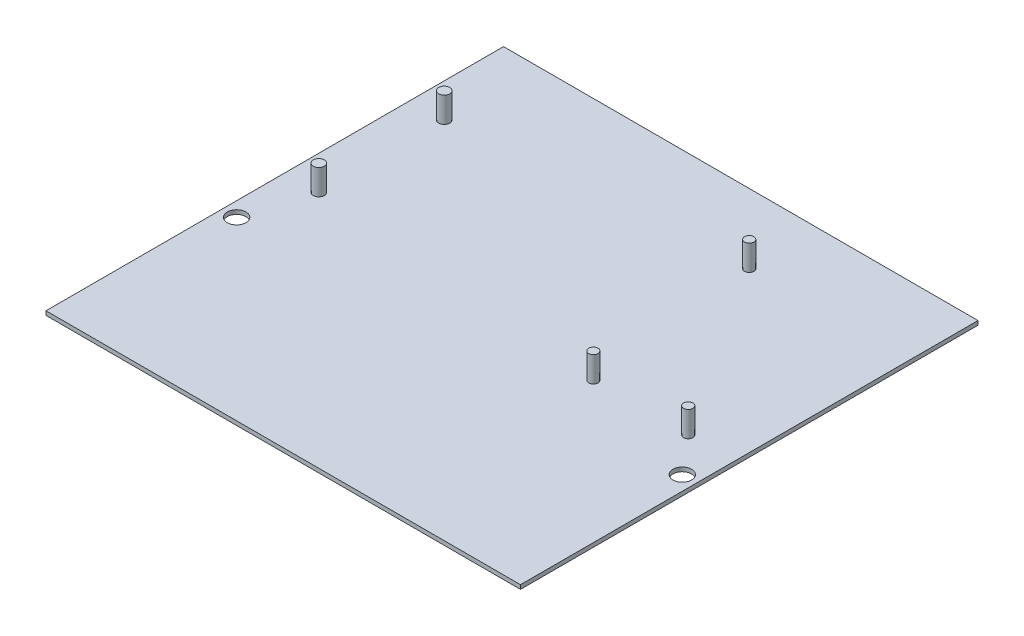
from build123d import *

# Parameters (mm, degrees)
SKETCH1_W           = 140
SKETCH1_H           = 135
BOSS_EXTRUDE1_DEPTH = 1.2
CUT_EXTRUDE1_REACH  = 99.251
SKETCH2_R           = 2.75
SKETCH3_R           = 1.625
BOSS_EXTRUDE2_DEPTH = 7.5
SKETCH4_R           = 1.375
BOSS_EXTRUDE3_DEPTH = 7.5


with BuildPart() as part:
    # Sketch1 → Boss-Extrude1 (new body)
    with BuildSketch(Plane(origin=(0, 0, 0), x_dir=(1, 0, 0), z_dir=(0, 1, 0))):
        Rectangle(SKETCH1_W, SKETCH1_H)
    extrude(amount=BOSS_EXTRUDE1_DEPTH)

    # Sketch2 → Cut-Extrude1 (cut, up to next)
    with BuildSketch(Plane(origin=(0, 1.2, 0), x_dir=(1, 0, 0), z_dir=(0, 1, 0)), mode=Mode.PRIVATE) as cut_extrude1_sk1:
        with Locations(Location((65.75, -15.5, 0), (0, 0, 270))):
            Circle(SKETCH2_R)
    cut_extrude1_tool1 = extrude(cut_extrude1_sk1.sketch, amount=-CUT_EXTRUDE1_REACH, mode=Mode.PRIVATE) & part.part
    cut_extrude1 = cut_extrude1_tool1.solids().sort_by_distance((65.75, 1.2, 15.5))[0]
    add(cut_extrude1, mode=Mode.SUBTRACT)

    # Mirror1: Cut-Extrude1 across plane
    add(cut_extrude1.mirror(Plane(origin=(0, 0, 0), x_dir=(0, 0, 1), z_dir=(1, 0, 0))), mode=Mode.SUBTRACT)

    # Sketch3 → Boss-Extrude2 (add)
    with BuildSketch(Plane(origin=(0, 1.2, 0), x_dir=(1, 0, 0), z_dir=(0, 1, 0))):
        with Locations(Location((-60, 40, 0), (0, 0, 270))):
            Circle(SKETCH3_R)
        with Locations(Location((-60, 3, 0), (0, 0, 270))):
            Circle(SKETCH3_R)
    extrude(amount=BOSS_EXTRUDE2_DEPTH)

    # Sketch4 → Boss-Extrude3 (add)
    with BuildSketch(Plane(origin=(0, 1.2, 0), x_dir=(1, 0, 0), z_dir=(0, 1, 0))):
        with Locations(Location((56.5, -4.5, 0), (0, 0, 270))):
            Circle(SKETCH4_R)
        with Locations(Location((28.5, -4.5, 0), (0, 0, 270))):
            Circle(SKETCH4_R)
        with Locations(Location((23, 47, 0), (0, 0, 270))):
            Circle(SKETCH4_R)
    extrude(amount=BOSS_EXTRUDE3_DEPTH)


solid = part.part
